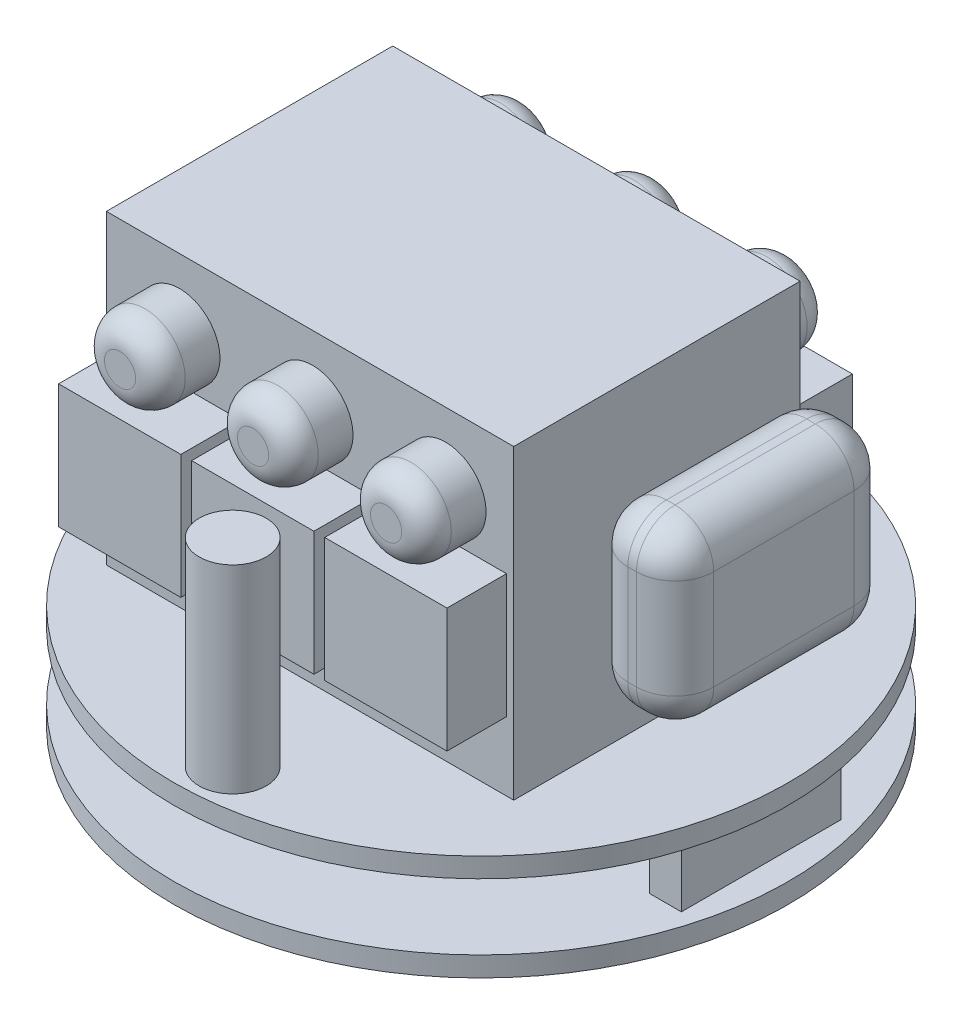
from build123d import *

# Parameters (mm, degrees)
SKETCH1_R               = 24.257
BOSS_EXTRUDE1_DEPTH     = 1.5748
SKETCH2_W               = 2.5146
SKETCH2_H               = 12.5984
BOSS_EXTRUDE2_DEPTH     = 5.207
SKETCH3_R               = 24.257
BOSS_EXTRUDE3_DEPTH     = 1.5494
SKETCH4_W               = 32.1564
SKETCH4_H               = 22.606
BOSS_EXTRUDE4_DEPTH     = 24.1808
SKETCH5_R               = 3.1877
SKETCH5_W               = 9.652
SKETCH5_H               = 9.779
BOSS_EXTRUDE5_DEPTH     = 4.699
LPATTERN1_COUNT         = 3
LPATTERN1_PITCH         = 10.5029
MIRROR1_COPY_1_SKETCH_R = 3.1877
MIRROR1_COPY_1_SKETCH_W = 9.652
MIRROR1_COPY_1_SKETCH_H = 9.779
MIRROR1_COPY_1_DEPTH    = 4.699
MIRROR1_COPY_2_SKETCH_R = 3.1877
MIRROR1_COPY_2_SKETCH_W = 9.652
MIRROR1_COPY_2_SKETCH_H = 9.779
MIRROR1_COPY_2_DEPTH    = 4.699
FILLET1_R               = 1.9558
SKETCH6_R               = 2.64795
BOSS_EXTRUDE6_DEPTH     = 15.6591
SKETCH7_W               = 17.1704
SKETCH7_H               = 13.97
BOSS_EXTRUDE7_DEPTH     = 6.7818
FILLET2_R               = 3.048
SKETCH9_R               = 5.5372
CUT_EXTRUDE1_DEPTH      = 19.8882


with BuildPart() as part:
    # Sketch1 → Boss-Extrude1 (new body)
    with BuildSketch(Plane(origin=(0, 0, 0), x_dir=(1, 0, 0), z_dir=(0, 1, 0))):
        with Locations(Location((0, 0, 0), (0, 0, 270))):
            Circle(SKETCH1_R)
    extrude(amount=BOSS_EXTRUDE1_DEPTH)

    # Sketch2 → Boss-Extrude2 (add)
    with BuildSketch(Plane(origin=(0, 1.5748, 0), x_dir=(1, 0, 0), z_dir=(0, 1, 0))):
        with Locations((-20.8534, 0)):
            Rectangle(SKETCH2_W, SKETCH2_H)
        with Locations((20.8534, 0)):
            Rectangle(SKETCH2_W, SKETCH2_H)
    extrude(amount=BOSS_EXTRUDE2_DEPTH)

    # Sketch3 → Boss-Extrude3 (add)
    with BuildSketch(Plane(origin=(0, 6.7818, 0), x_dir=(1, 0, 0), z_dir=(0, 1, 0))):
        with Locations(Location((0, 0, 0), (0, 0, 270))):
            Circle(SKETCH3_R)
    extrude(amount=BOSS_EXTRUDE3_DEPTH)

    # Sketch4 → Boss-Extrude4 (add)
    with BuildSketch(Plane(origin=(0, 8.3312, 0), x_dir=(1, 0, 0), z_dir=(0, 1, 0))):
        with Locations((-1.4605, -0.7366)):
            Rectangle(SKETCH4_W, SKETCH4_H)
    extrude(amount=BOSS_EXTRUDE4_DEPTH)

    # Sketch5 → Boss-Extrude5 (add)
    with BuildSketch(Plane.XY.offset(12.0396)):
        with Locations(Location((9.2456, 26.9367, 0), (0, 0, 180))):
            Circle(SKETCH5_R)
        with Locations((9.2202, 18.6436)):
            Rectangle(SKETCH5_W, SKETCH5_H)
    boss_extrude5 = extrude(amount=BOSS_EXTRUDE5_DEPTH)

    # LPattern1: Boss-Extrude5 ×3
    with Locations(*[(-i * LPATTERN1_PITCH, 0, 0) for i in range(1, LPATTERN1_COUNT)]):
        add(boss_extrude5)

    # Mirror1: Boss-Extrude5 across plane
    add(boss_extrude5.mirror(Plane.XY.offset(0.7366)))

    # Mirror1 copy 1 sketch → Mirror1 copy 1 (add)
    with BuildSketch(Plane(origin=(-10.5029, 0, -10.5664), x_dir=(1, 0, 0), z_dir=(0, 0, -1))):
        with Locations((9.2456, -26.9367)):
            Circle(MIRROR1_COPY_1_SKETCH_R)
        with Locations((9.2202, -18.6436)):
            Rectangle(MIRROR1_COPY_1_SKETCH_W, MIRROR1_COPY_1_SKETCH_H)
    extrude(amount=MIRROR1_COPY_1_DEPTH)

    # Mirror1 copy 2 sketch → Mirror1 copy 2 (add)
    with BuildSketch(Plane(origin=(-21.0058, 0, -10.5664), x_dir=(1, 0, 0), z_dir=(0, 0, -1))):
        with Locations((9.2456, -26.9367)):
            Circle(MIRROR1_COPY_2_SKETCH_R)
        with Locations((9.2202, -18.6436)):
            Rectangle(MIRROR1_COPY_2_SKETCH_W, MIRROR1_COPY_2_SKETCH_H)
    extrude(amount=MIRROR1_COPY_2_DEPTH)

    # Fillet1
    fillet1_edges = [part.edges().sort_by_distance(p)[0] for p in [
        (12.4333, 26.9367, -15.2654),
        (-4.445, 26.9367, -15.2654),
        (-14.9479, 26.9367, -15.2654),
        (12.4333, 26.9367, 16.7386),
        (1.9304, 26.9367, 16.7386),
        (-8.5725, 26.9367, 16.7386),
    ]]
    fillet(fillet1_edges, radius=FILLET1_R)

    # Sketch6 → Boss-Extrude6 (add)
    with BuildSketch(Plane(origin=(0, 8.3312, 0), x_dir=(1, 0, 0), z_dir=(0, 1, 0))):
        with Locations(Location((1.22555, -20.83435, 0), (0, 0, 270))):
            Circle(SKETCH6_R)
    extrude(amount=BOSS_EXTRUDE6_DEPTH)

    # Sketch9 → Cut-Extrude1 (cut)
    with BuildSketch(Plane.XZ):
        with Locations(Location((0, 0, 0), (0, 0, 270))):
            Circle(SKETCH9_R)
    extrude(amount=-CUT_EXTRUDE1_DEPTH, mode=Mode.SUBTRACT)


with BuildPart() as body_2:
    # Sketch7 → Boss-Extrude7 (new body)
    with BuildSketch(Plane(origin=(14.6177, 0, 0), x_dir=(0, 0, -1), z_dir=(1, 0, 0))):
        with Locations((2.5019, 18.8976)):
            Rectangle(SKETCH7_W, SKETCH7_H)
    extrude(amount=BOSS_EXTRUDE7_DEPTH)

    # Fillet2
    fillet2_edges = [body_2.edges().sort_by_distance(p)[0] for p in [
        (21.3995, 18.8976, -11.0871),
        (21.3995, 25.8826, -2.5019),
        (21.3995, 18.8976, 6.0833),
        (14.6177, 25.8826, -2.5019),
        (14.6177, 18.8976, -11.0871),
        (14.6177, 11.9126, -2.5019),
        (14.6177, 18.8976, 6.0833),
        (18.0086, 25.8826, 6.0833),
        (18.0086, 25.8826, -11.0871),
        (18.0086, 11.9126, -11.0871),
        (18.0086, 11.9126, 6.0833),
        (21.3995, 11.9126, -2.5019),
    ]]
    fillet(fillet2_edges, radius=FILLET2_R)


solid = Compound([part.part, body_2.part])
